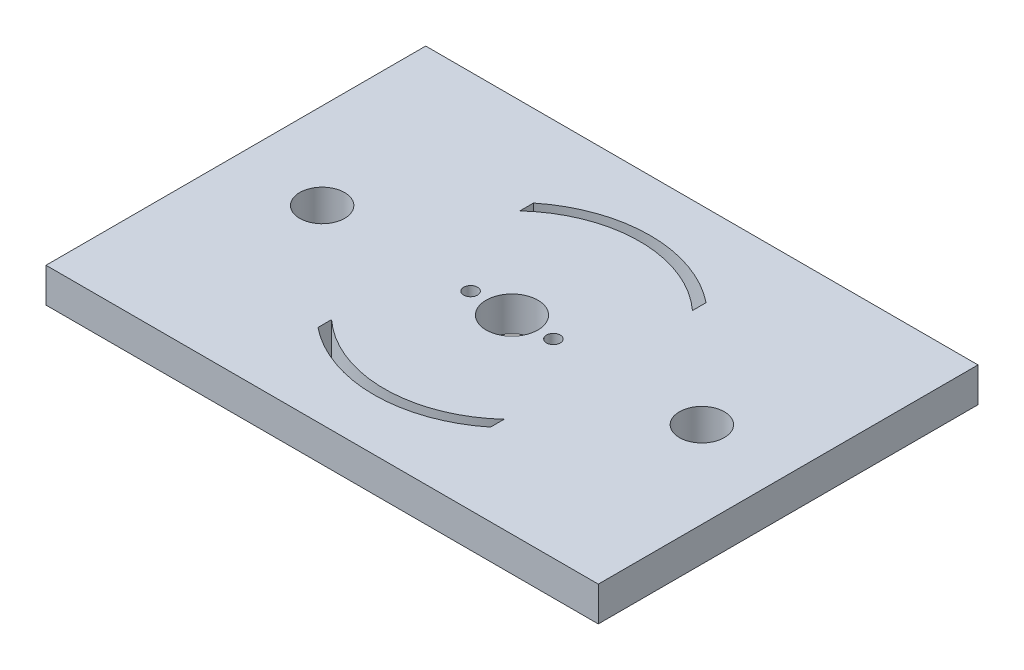
from build123d import *

# Parameters (mm, degrees)
SKETCH1_W           = 160
SKETCH1_H           = 110
SKETCH1_R           = 6.5
SKETCH1_R_2         = 7.5
BOSS_EXTRUDE1_DEPTH = 10
SKETCH2_R           = 2
CUT_EXTRUDE1_DEPTH  = 5


with BuildPart() as part:
    # Sketch1 → Boss-Extrude1 (new body)
    with BuildSketch(Plane(origin=(0, 0, 0), x_dir=(1, 0, 0), z_dir=(0, 1, 0))):
        Rectangle(SKETCH1_W, SKETCH1_H)
        with Locations(Location((-55, 0, 0), (0, 0, 270))):
            Circle(SKETCH1_R, mode=Mode.SUBTRACT)
        with Locations(Location((55, 0, 0), (0, 0, 90))):
            Circle(SKETCH1_R, mode=Mode.SUBTRACT)
        with Locations(Location((0, 0, 0), (0, 0, 270))):
            Circle(SKETCH1_R_2, mode=Mode.SUBTRACT)
        with BuildLine():
            Line((-25, 31.224989992), (-25, 27.276363394))
            ThreePointArc((-25, 27.276363394), (0, 37), (25, 27.276363394))
            Line((25, 27.276363394), (25, 31.224989992))
            ThreePointArc((25, 31.224989992), (0, 40), (-25, 31.224989992))
        make_face(mode=Mode.SUBTRACT)
        with BuildLine():
            Line((-25, -27.276363394), (-25, -31.224989992))
            ThreePointArc((-25, -31.224989992), (0, -40), (25, -31.224989992))
            Line((25, -31.224989992), (25, -27.276363394))
            ThreePointArc((25, -27.276363394), (0, -37), (-25, -27.276363394))
        make_face(mode=Mode.SUBTRACT)
    extrude(amount=BOSS_EXTRUDE1_DEPTH)

    # Sketch2 → Cut-Extrude1 (cut)
    with BuildSketch(Plane(origin=(0, 10, 0), x_dir=(1, 0, 0), z_dir=(0, 1, 0))):
        with Locations(Location((-12, 0, 0), (0, 0, 270))):
            Circle(SKETCH2_R)
        with Locations(Location((12, 0, 0), (0, 0, 90))):
            Circle(SKETCH2_R)
    extrude(amount=-CUT_EXTRUDE1_DEPTH, mode=Mode.SUBTRACT)


solid = part.part
